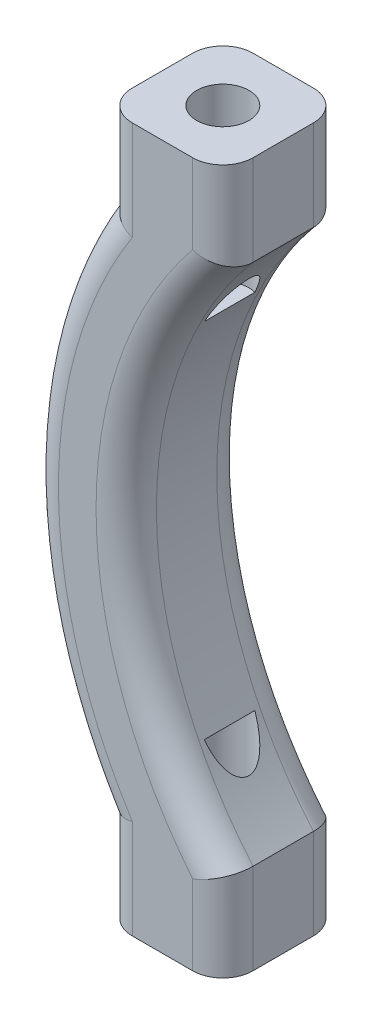
from build123d import *

# Parameters (mm, degrees)
SKETCH1_W             = 6
SKETCH1_H             = 4.5
BOSS_EXTRUDE1_DEPTH   = 6
HOLE1_D               = 2.6
HOLE1_DEPTH           = 8.5
HOLE1_ON_FACE_2_D     = 2.6
HOLE1_ON_FACE_2_DEPTH = 8.5
FILLET1_R             = 1.5


with BuildPart() as part:
    # Sketch1 → Boss-Extrude1 (new body)
    with BuildSketch(Plane.XY):
        with BuildLine():
            Line((1.198715271, 28.132291187), (-4.801284729, 28.132291187))
            ThreePointArc((-4.801284729, 28.132291187), (-8.469932757, 15.132291187), (-4.801284729, 2.132291187))
            Line((-4.801284729, 2.132291187), (1.198715271, 2.132291187))
            ThreePointArc((1.198715271, 2.132291187), (-3.602600575, 15.132291187), (1.198715271, 28.132291187))
        make_face()
        with Locations((-1.801284729, 30.382291187)):
            Rectangle(SKETCH1_W, SKETCH1_H)
        with Locations((-1.801284729, -0.117708813)):
            Rectangle(SKETCH1_W, SKETCH1_H)
    extrude(amount=BOSS_EXTRUDE1_DEPTH)

    # Hole1
    with Locations(Plane(origin=(-1.801284729, 32.632291187, 3), x_dir=(0, 0, 1), z_dir=(0, 1, 0))):
        with Locations((0, 0)):
            Hole(HOLE1_D / 2, depth=HOLE1_DEPTH)

    # Hole1 on face 2
    with Locations(Plane(origin=(-1.801284729, -2.367708813, 3), x_dir=(0, 0, -1), z_dir=(0, -1, 0))):
        with Locations((0, 0)):
            Hole(HOLE1_ON_FACE_2_D / 2, depth=HOLE1_ON_FACE_2_DEPTH)

    # Fillet1
    fillet1_edges = [part.edges().sort_by_distance(p)[0] for p in [
        (1.198715271, 30.382291187, 6),
        (-4.801284729, -0.117708813, 0),
        (-8.469932757, 15.132291187, 0),
        (-4.801284729, 30.382291187, 0),
        (1.198715271, 30.382291187, 0),
        (-3.602600575, 15.132291187, 0),
        (-4.801284729, 30.382291187, 6),
        (-8.469932757, 15.132291187, 6),
        (-4.801284729, -0.117708813, 6),
        (1.198715271, -0.117708813, 6),
        (-3.602600575, 15.132291187, 6),
        (1.198715271, -0.117708813, 0),
    ]]
    fillet(fillet1_edges, radius=FILLET1_R)


solid = part.part
